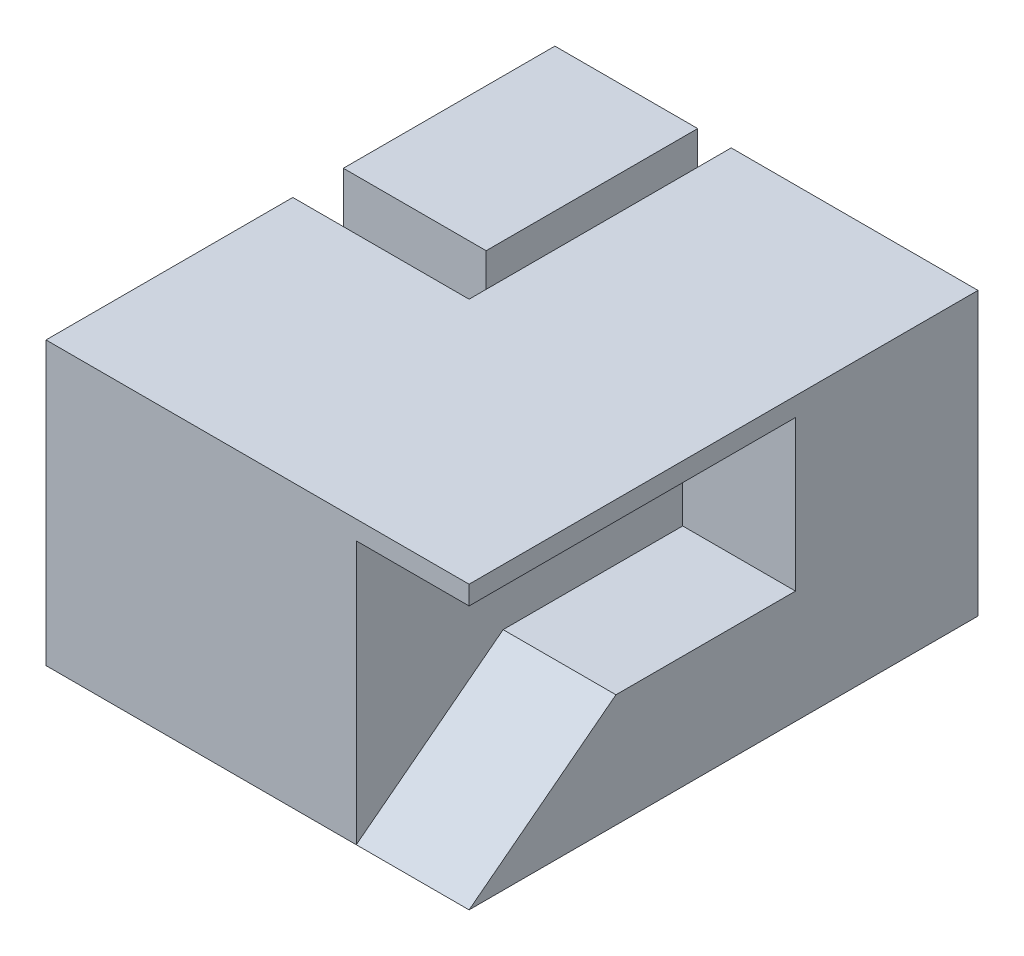
from build123d import *

# Parameters (mm, degrees)
EXTRUDE_1_DEPTH     = 40
SKETCH_1_W          = 20.251594387
SKETCH_1_H          = 30
EXTRUDE_1_2_DEPTH   = 40
CUT_EXTRUDE_1_DEPTH = 16


with BuildPart() as part:
    # 草图1 → 凸台-拉伸1 (new body)
    with BuildSketch(Plane(origin=(0, 0, 0), x_dir=(1, 0, 0), z_dir=(0, 1, 0))):
        Polygon((-53.866046678, 14.175497418), (-53.866046678, -20.824502582), (6.133953322, -20.824502582), (6.133953322, 51.344711422), (-28.866046678, 51.344711422), (-28.866046678, 14.175497418), align=None)
    extrude(amount=EXTRUDE_1_DEPTH)

    # 草图2 → 切除-拉伸1 (cut)
    with BuildSketch(Plane(origin=(6.133953322, 0, 0), x_dir=(0, 0, -1), z_dir=(1, 0, 0))):
        Polygon((-20.824502582, 37.326931886), (25.465428213, 37.326931886), (25.465428213, 16.006959993), (0, 16.006959993), (-20.824502582, 0), align=None)
    extrude(amount=-CUT_EXTRUDE_1_DEPTH, mode=Mode.SUBTRACT)


with BuildPart() as body_2:
    # 草图1 → Extrude 1 2 (new body)
    with BuildSketch(Plane(origin=(0, 0, 0), x_dir=(1, 0, 0), z_dir=(0, 1, 0))):
        with Locations((-43.740249484, 36.344711422)):
            Rectangle(SKETCH_1_W, SKETCH_1_H)
    extrude(amount=EXTRUDE_1_2_DEPTH)


solid = Compound([part.part, body_2.part])
